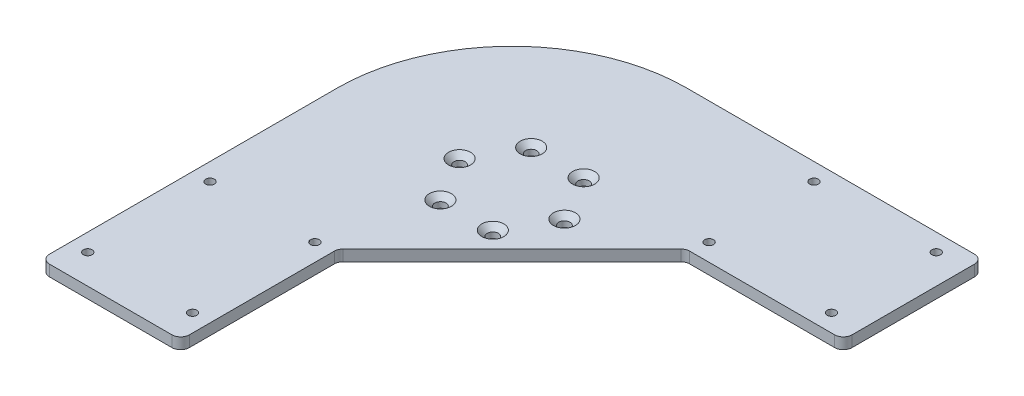
from build123d import *

# Parameters (mm, degrees)
BOSS_EXTRUDE1_DEPTH                             = 6.35
FILLET1_R                                       = 5
TAP_DRILL_FOR_M6X1_0_TAP1_D                     = 5
CSK_FOR_M6_FLAT_HEAD_MACHINE_SCREW1_D           = 6.4
CSK_FOR_M6_FLAT_HEAD_MACHINE_SCREW1_CSINK_D     = 12.6
CSK_FOR_M6_FLAT_HEAD_MACHINE_SCREW1_CSINK_ANGLE = 90


with BuildPart() as part:
    # Sketch1 → Boss-Extrude1 (new body)
    with BuildSketch(Plane(origin=(0, 0, 0), x_dir=(1, 0, 0), z_dir=(0, 1, 0))):
        with BuildLine():
            Line((0, 100), (169.625, 100))
            Line((169.625, 100), (169.625, 20))
            Line((169.625, 20), (79.625, 20))
            Line((79.625, 20), (-20, -79.625))
            Line((-20, -79.625), (-20, -169.625))
            Line((-20, -169.625), (-100, -169.625))
            Line((-100, -169.625), (-100, 0))
            ThreePointArc((-100, 0), (-70.710678119, 70.710678119), (0, 100))
        make_face()
    extrude(amount=-BOSS_EXTRUDE1_DEPTH)

    # Fillet1
    fillet1_edges = [part.edges().sort_by_distance(p)[0] for p in [
        (169.625, -3.175, -20),
        (79.625, -3.175, -20),
        (-20, -3.175, 79.625),
        (-20, -3.175, 169.625),
        (-100, -3.175, 169.625),
        (169.625, -3.175, -100),
    ]]
    fillet(fillet1_edges, radius=FILLET1_R)

    # Tap Drill for M6x1.0 Tap1 (through all)
    with Locations(Plane(origin=(82.8, 0, -90), x_dir=(0, 0, 1), z_dir=(0, 1, 0))):
        with Locations((0, 0), (0, 70), (60, 70), (172.8, -172.8), (172.8, -112.8), (242.8, -112.8), (242.8, -172.8), (60, 0)):
            Hole(TAP_DRILL_FOR_M6X1_0_TAP1_D / 2)

    # CSK for M6 Flat Head Machine Screw1 (through all)
    with Locations(Plane(origin=(15, 0, -25.980762114), x_dir=(0, 0, 1), z_dir=(0, 1, 0))):
        with Locations((0, 0), (25.980762114, 15), (51.961524228, 0), (51.961524228, -30), (25.980762114, -45), (0, -30)):
            CounterSinkHole(CSK_FOR_M6_FLAT_HEAD_MACHINE_SCREW1_D / 2, CSK_FOR_M6_FLAT_HEAD_MACHINE_SCREW1_CSINK_D / 2, counter_sink_angle=CSK_FOR_M6_FLAT_HEAD_MACHINE_SCREW1_CSINK_ANGLE)


solid = part.part
